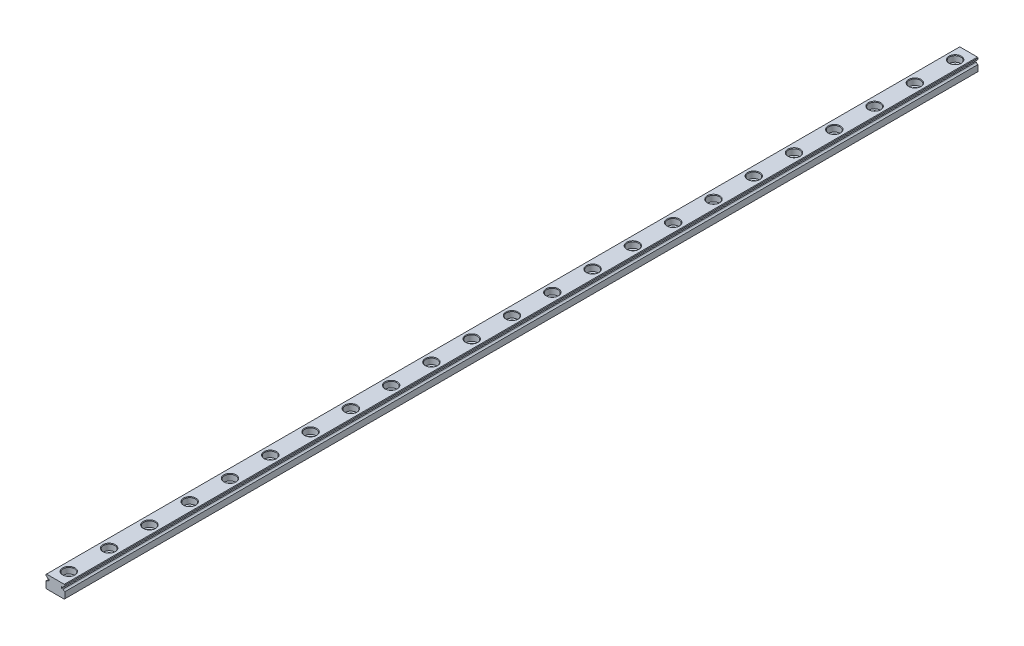
from build123d import *

# Parameters (mm, degrees)
EXTRUDE1_DEPTH             = 340
EXTRUDE2_REACH             = 342.052
SKETCH2_R                  = 1.2
SKETCH_R                   = 2.1
SKETCH_R_2                 = 1.2
EXTRUDE4_DEPTH             = 2.3
CHAMFER1_SIZE              = 0.2
LPATTERN1_COUNT            = 23
LPATTERN1_PITCH            = 15
CHAMFER1_OF_LPATTERN1_SIZE = 0.2


with BuildPart() as part:
    # Sketch1 → Extrude1 (new body)
    with BuildSketch(Plane.XY):
        with BuildLine():
            Line((-3.3, -2.4), (3.3, -2.4))
            Line((3.3, -2.4), (3.5, -2.2))
            Line((3.5, -2.2), (3.5, 0.106274607))
            ThreePointArc((3.5, 0.106274607), (3.091294745, 0.282570681), (2.840065792, 0.65))
            Line((2.840065792, 0.65), (2.340065792, 0.65))
            Line((2.340065792, 0.65), (2.340065792, 1.15))
            Line((2.340065792, 1.15), (2.840065792, 1.15))
            ThreePointArc((2.840065792, 1.15), (3.091294745, 1.517429319), (3.5, 1.693725393))
            Line((3.5, 1.693725393), (3.5, 2.2))
            Line((3.5, 2.2), (3.3, 2.4))
            Line((3.3, 2.4), (-3.3, 2.4))
            Line((-3.3, 2.4), (-3.5, 2.2))
            Line((-3.5, 2.2), (-3.5, 1.693725393))
            ThreePointArc((-3.5, 1.693725393), (-3.091294745, 1.517429319), (-2.840065792, 1.15))
            Line((-2.840065792, 1.15), (-2.340065792, 1.15))
            Line((-2.340065792, 1.15), (-2.340065792, 0.65))
            Line((-2.340065792, 0.65), (-2.840065792, 0.65))
            ThreePointArc((-2.840065792, 0.65), (-3.091294745, 0.282570681), (-3.5, 0.106274607))
            Line((-3.5, 0.106274607), (-3.5, -2.2))
            Line((-3.5, -2.2), (-3.3, -2.4))
        make_face()
    extrude(amount=EXTRUDE1_DEPTH)

    # Sketch2 → Extrude2 (cut, up to next)
    with BuildSketch(Plane(origin=(0, 2.4, 0), x_dir=(1, 0, 0), z_dir=(0, 1, 0)), mode=Mode.PRIVATE) as extrude2_sk1:
        with Locations((0, -5)):
            Circle(SKETCH2_R)
    extrude2_tool1 = extrude(extrude2_sk1.sketch, amount=-EXTRUDE2_REACH, mode=Mode.PRIVATE) & part.part
    extrude2 = extrude2_tool1.solids().sort_by_distance((0, 2.4, 5))[0]
    add(extrude2, mode=Mode.SUBTRACT)

    # Sketch → Extrude4 (cut)
    with BuildSketch(Plane(origin=(0, 2.4, 0), x_dir=(1, 0, 0), z_dir=(0, 1, 0))):
        with Locations((0, -5)):
            Circle(SKETCH_R)
        with Locations((0, -5)):
            Circle(SKETCH_R_2, mode=Mode.SUBTRACT)
    extrude4 = extrude(amount=-EXTRUDE4_DEPTH, mode=Mode.SUBTRACT)

    # Chamfer1
    chamfer1_edges = [part.edges().sort_by_distance(p)[0] for p in [
        (-1.2, -2.4, 5),
        (-2.1, 2.4, 5),
    ]]
    chamfer(chamfer1_edges, length=CHAMFER1_SIZE)

    # LPattern1: Extrude2, Extrude4 ×23
    with Locations(*[(0, 0, i * LPATTERN1_PITCH) for i in range(1, LPATTERN1_COUNT)]):
        add(extrude2, mode=Mode.SUBTRACT)
        add(extrude4, mode=Mode.SUBTRACT)

    # Chamfer1 of LPattern1
    chamfer1_of_lpattern1_edges = [part.edges().sort_by_distance(p)[0] for p in [
        (-1.2, -2.4, 20),
        (-2.1, 2.4, 20),
        (-1.2, -2.4, 35),
        (-2.1, 2.4, 35),
        (-1.2, -2.4, 50),
        (-2.1, 2.4, 50),
        (-1.2, -2.4, 65),
        (-2.1, 2.4, 65),
        (-1.2, -2.4, 80),
        (-2.1, 2.4, 80),
        (-1.2, -2.4, 95),
        (-2.1, 2.4, 95),
        (-1.2, -2.4, 110),
        (-2.1, 2.4, 110),
        (-1.2, -2.4, 125),
        (-2.1, 2.4, 125),
        (-1.2, -2.4, 140),
        (-2.1, 2.4, 140),
        (-1.2, -2.4, 155),
        (-2.1, 2.4, 155),
        (-1.2, -2.4, 170),
        (-2.1, 2.4, 170),
        (-1.2, -2.4, 185),
        (-2.1, 2.4, 185),
        (-1.2, -2.4, 200),
        (-2.1, 2.4, 200),
        (-1.2, -2.4, 215),
        (-2.1, 2.4, 215),
        (-1.2, -2.4, 230),
        (-2.1, 2.4, 230),
        (-1.2, -2.4, 245),
        (-2.1, 2.4, 245),
        (-1.2, -2.4, 260),
        (-2.1, 2.4, 260),
        (-1.2, -2.4, 275),
        (-2.1, 2.4, 275),
        (-1.2, -2.4, 290),
        (-2.1, 2.4, 290),
        (-1.2, -2.4, 305),
        (-2.1, 2.4, 305),
        (-1.2, -2.4, 320),
        (-2.1, 2.4, 320),
        (-1.2, -2.4, 335),
        (-2.1, 2.4, 335),
    ]]
    chamfer(chamfer1_of_lpattern1_edges, length=CHAMFER1_OF_LPATTERN1_SIZE)


solid = part.part
